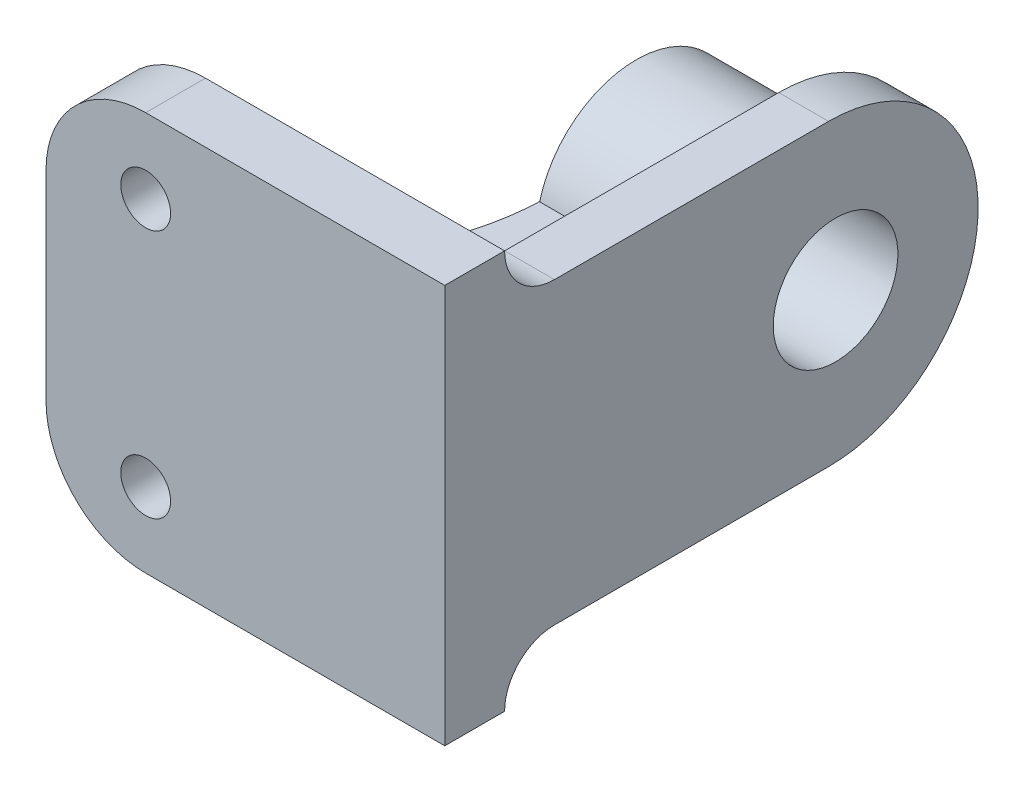
from build123d import *

# Parameters (mm, degrees)
BOSS_EXTRUDE1_DEPTH = 12
CUT_EXTRUDE1_REACH  = 115.772
SKETCH2_R           = 5
BOSS_EXTRUDE2_DEPTH = 10
SKETCH8_R           = 20
BOSS_EXTRUDE3_DEPTH = 30
CUT_EXTRUDE2_REACH  = 132.48
SKETCH9_R           = 12.5
BOSS_EXTRUDE4_DEPTH = 5


with BuildPart() as part:
    # Sketch1 → Boss-Extrude1 (new body)
    with BuildSketch(Plane.XY):
        with BuildLine():
            Line((20, 0), (80, 0))
            Line((80, 0), (80, 80))
            Line((80, 80), (20, 80))
            ThreePointArc((20, 80), (5.857864376, 74.142135624), (0, 60))
            Line((0, 60), (0, 20))
            ThreePointArc((0, 20), (5.857864376, 5.857864376), (20, 0))
        make_face()
    extrude(amount=BOSS_EXTRUDE1_DEPTH)

    # Sketch2 → Cut-Extrude1 (cut, up to next)
    with BuildSketch(Plane.XY.offset(12), mode=Mode.PRIVATE) as cut_extrude1_sk1:
        with Locations((20, 65)):
            Circle(SKETCH2_R)
    cut_extrude1_tool1 = extrude(cut_extrude1_sk1.sketch, amount=-CUT_EXTRUDE1_REACH, mode=Mode.PRIVATE) & part.part
    # Sketch2 → Cut-Extrude1 (cut, up to next)
    with BuildSketch(Plane.XY.offset(12), mode=Mode.PRIVATE) as cut_extrude1_sk2:
        with Locations((20, 15)):
            Circle(SKETCH2_R)
    cut_extrude1_tool2 = extrude(cut_extrude1_sk2.sketch, amount=-CUT_EXTRUDE1_REACH, mode=Mode.PRIVATE) & part.part
    add(cut_extrude1_tool1.solids().sort_by_distance((20, 65, 12))[0], mode=Mode.SUBTRACT)
    add(cut_extrude1_tool2.solids().sort_by_distance((20, 15, 12))[0], mode=Mode.SUBTRACT)

    # Sketch5 → Boss-Extrude2 (add)
    with BuildSketch(Plane(origin=(80, 0, 0), x_dir=(0, 0, -1), z_dir=(1, 0, 0))):
        with BuildLine():
            Line((10, 70), (65, 70))
            ThreePointArc((65, 70), (95, 40), (65, 10))
            Line((65, 10), (10, 10))
            ThreePointArc((10, 10), (2.928932188, 7.071067812), (0, 0))
            Line((0, 0), (0, 80))
            ThreePointArc((0, 80), (2.928932188, 72.928932188), (10, 70))
        make_face()
    extrude(amount=-BOSS_EXTRUDE2_DEPTH)

    # Sketch8 → Boss-Extrude3 (add)
    with BuildSketch(Plane.ZY.offset(-70)):
        with Locations(Location((-66.398885529, 40, 0), (0, 0, 180))):
            Circle(SKETCH8_R)
    extrude(amount=BOSS_EXTRUDE3_DEPTH)

    # Sketch9 → Cut-Extrude2 (cut, up to next)
    with BuildSketch(Plane.ZY.offset(-40), mode=Mode.PRIVATE) as cut_extrude2_sk1:
        with Locations((-66.398885529, 40)):
            Circle(SKETCH9_R)
    cut_extrude2_tool1 = extrude(cut_extrude2_sk1.sketch, amount=-CUT_EXTRUDE2_REACH, mode=Mode.PRIVATE) & part.part
    add(cut_extrude2_tool1.solids().sort_by_distance((40, 40, -66.398886))[0], mode=Mode.SUBTRACT)

    # Sketch16 → Boss-Extrude4 (add, symmetric)
    with BuildSketch(Plane(origin=(0, 40, 0), x_dir=(1, 0, 0), z_dir=(0, 1, 0))):
        with BuildLine():
            Line((40, 48.219297795), (70, 48.219297795))
            Line((70, 48.219297795), (70, 0))
            Line((70, 0), (0, 0))
            ThreePointArc((0, 0), (28.488651348, 17.067944239), (40, 48.219297795))
        make_face()
    extrude(amount=BOSS_EXTRUDE4_DEPTH, both=True)


solid = part.part
